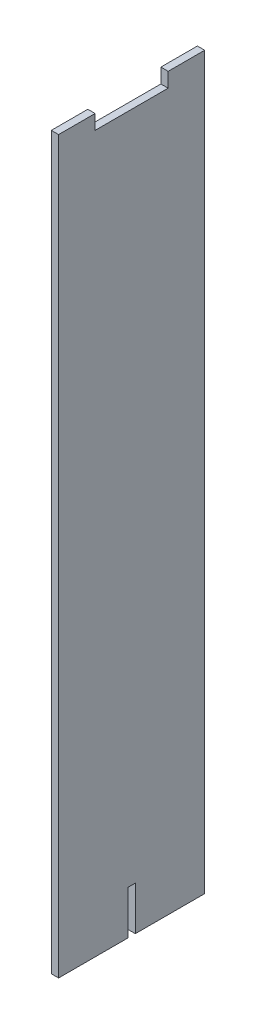
from build123d import *

# Parameters (mm, degrees)
BOSS_EXTRUDE1_DEPTH = 10
SKETCH2_W           = 100
SKETCH2_H           = 20
CUT_EXTRUDE1_DEPTH  = 10


with BuildPart() as part:
    # Sketch1 → Boss-Extrude1 (new body)
    with BuildSketch(Plane(origin=(0, 0, 0), x_dir=(0, 0, -1), z_dir=(1, 0, 0))):
        Polygon((100, 16.263736264), (-100, 16.263736264), (-100, -983.736263736), (-5, -983.736263736), (-5, -923.736263736), (5, -923.736263736), (5, -983.736263736), (100, -983.736263736), align=None)
    extrude(amount=BOSS_EXTRUDE1_DEPTH)

    # Sketch2 → Cut-Extrude1 (cut)
    with BuildSketch(Plane.ZY):
        with Locations((0, 6.263736264)):
            Rectangle(SKETCH2_W, SKETCH2_H)
    extrude(amount=-CUT_EXTRUDE1_DEPTH, mode=Mode.SUBTRACT)


solid = part.part
